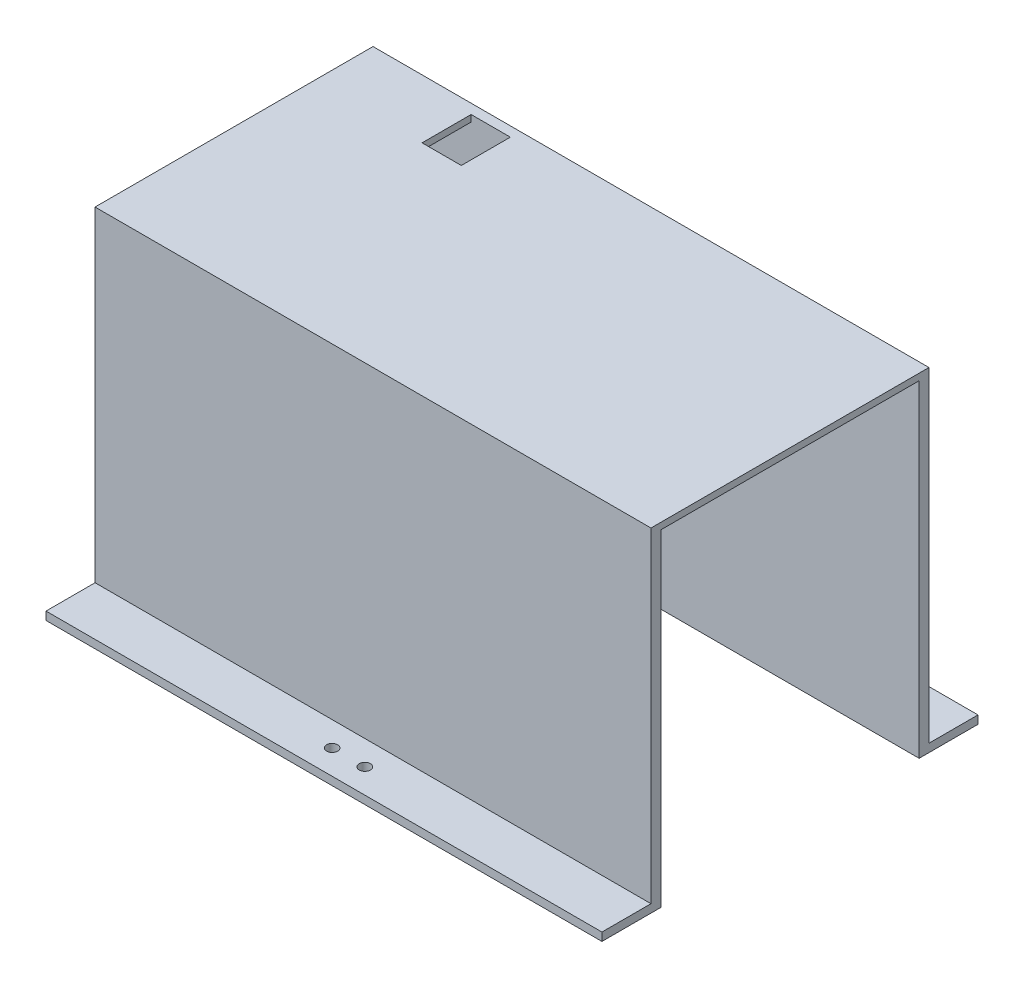
from build123d import *

# Parameters (mm, degrees)
SKETCH2_W           = 170
SKETCH2_H           = 85
BOSS_EXTRUDE1_DEPTH = 2
SKETCH3_W           = 12
SKETCH3_H           = 15
CUT_EXTRUDE1_DEPTH  = 106.73546699
SKETCH6_W           = 170
SKETCH6_H           = 3
BOSS_EXTRUDE2_DEPTH = 100
SKETCH7_W           = 170
SKETCH7_H           = 2.5
BOSS_EXTRUDE3_DEPTH = 15
SKETCH8_W           = 170
SKETCH8_H           = 2.5
BOSS_EXTRUDE4_DEPTH = 15
SKETCH9_R           = 1.7
CUT_EXTRUDE3_DEPTH  = 151.557944579
SKETCH11_R          = 1.7
CUT_EXTRUDE4_DEPTH  = 151.557944579


with BuildPart() as part:
    # Sketch2 → Boss-Extrude1 (new body)
    with BuildSketch(Plane(origin=(0, 0, 0), x_dir=(1, 0, 0), z_dir=(0, 1, 0))):
        with Locations((10.400843882, -3.048523207)):
            Rectangle(SKETCH2_W, SKETCH2_H)
    extrude(amount=BOSS_EXTRUDE1_DEPTH)

    # Sketch3 → Cut-Extrude1 (cut, through all)
    with BuildSketch(Plane(origin=(0, 2, 0), x_dir=(1, 0, 0), z_dir=(0, 1, 0))):
        with Locations((-35.599156118, 28.951476793)):
            Rectangle(SKETCH3_W, SKETCH3_H)
    extrude(amount=-CUT_EXTRUDE1_DEPTH, mode=Mode.SUBTRACT)

    # Sketch6 → Boss-Extrude2 (add)
    with BuildSketch(Plane.XZ):
        with Locations((10.400843882, -37.951476793)):
            Rectangle(SKETCH6_W, SKETCH6_H)
        with Locations((10.400843882, 44.048523207)):
            Rectangle(SKETCH6_W, SKETCH6_H)
    extrude(amount=BOSS_EXTRUDE2_DEPTH)

    # Sketch7 → Boss-Extrude3 (add)
    with BuildSketch(Plane(origin=(0, 0, -39.451476793), x_dir=(-1, 0, 0), z_dir=(0, 0, -1))):
        with Locations((-10.400843882, -98.75)):
            Rectangle(SKETCH7_W, SKETCH7_H)
    extrude(amount=BOSS_EXTRUDE3_DEPTH)

    # Sketch8 → Boss-Extrude4 (add)
    with BuildSketch(Plane.XY.offset(45.548523207)):
        with Locations((10.400843882, -98.75)):
            Rectangle(SKETCH8_W, SKETCH8_H)
    extrude(amount=BOSS_EXTRUDE4_DEPTH)

    # Sketch9 → Cut-Extrude3 (cut, through all)
    with BuildSketch(Plane(origin=(0, -97.5, 0), x_dir=(1, 0, 0), z_dir=(0, 1, 0))):
        with Locations(Location((5.400843882, -53.048523207, 0), (0, 0, 270))):
            Circle(SKETCH9_R)
        with Locations(Location((15.400843882, -53.048523207, 0), (0, 0, 270))):
            Circle(SKETCH9_R)
    extrude(amount=-CUT_EXTRUDE3_DEPTH, mode=Mode.SUBTRACT)

    # Sketch11 → Cut-Extrude4 (cut, through all)
    with BuildSketch(Plane(origin=(0, -97.5, 0), x_dir=(1, 0, 0), z_dir=(0, 1, 0))):
        with Locations(Location((5.400843882, 46.951476793, 0), (0, 0, 270))):
            Circle(SKETCH11_R)
        with Locations(Location((15.400843882, 46.951476793, 0), (0, 0, 270))):
            Circle(SKETCH11_R)
    extrude(amount=-CUT_EXTRUDE4_DEPTH, mode=Mode.SUBTRACT)


solid = part.part
